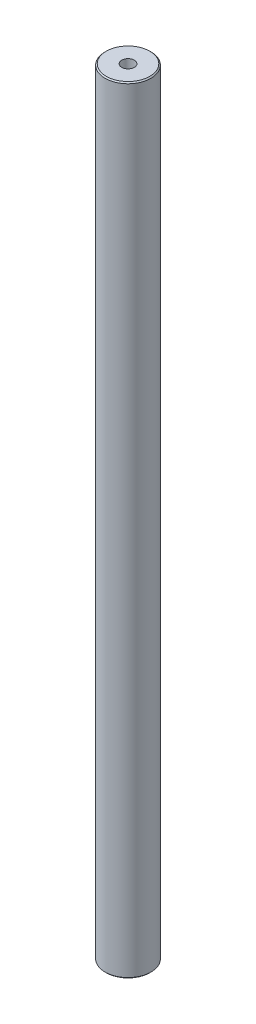
from build123d import *


with BuildPart() as part:
    # Esboço1 → Revolução1 (revolve)
    with BuildSketch(Plane.XY, mode=Mode.PRIVATE) as revolu_o1_sk:
        Polygon((1.65, 205.2), (0, 205.2), (0, 22), (1.65, 22), (1.65, 12), (5.7, 12), (6, 12.3), (6, 214.9), (5.7, 215.2), (1.65, 215.2), align=None)
    revolve(revolu_o1_sk.sketch.rotate(Axis((0, 215.2, 0), (0, -1, 0)), 270), axis=Axis((0, 215.2, 0), (0, -1, 0)))


solid = part.part
